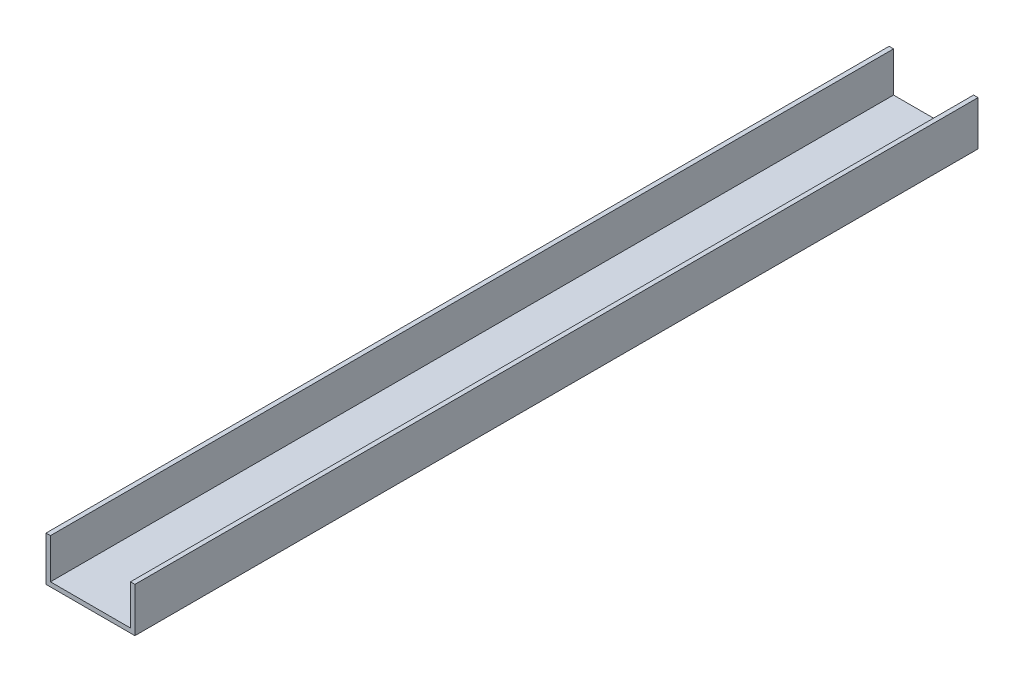
from build123d import *

# Parameters (mm, degrees)
ESTRUSIONE_ESTRUSIONE1_DEPTH = 569


with BuildPart() as part:
    # Schizzo1 → Estrusione-Estrusione1 (new body)
    with BuildSketch(Plane.XY):
        Polygon((-22.986722187, -3.313953488), (37.013277813, -3.313953488), (37.013277813, 26.686046512), (34.013277813, 26.686046512), (34.013277813, -0.313953488), (-19.986722187, -0.313953488), (-19.986722187, 26.686046512), (-22.986722187, 26.686046512), align=None)
    extrude(amount=ESTRUSIONE_ESTRUSIONE1_DEPTH)


solid = part.part
